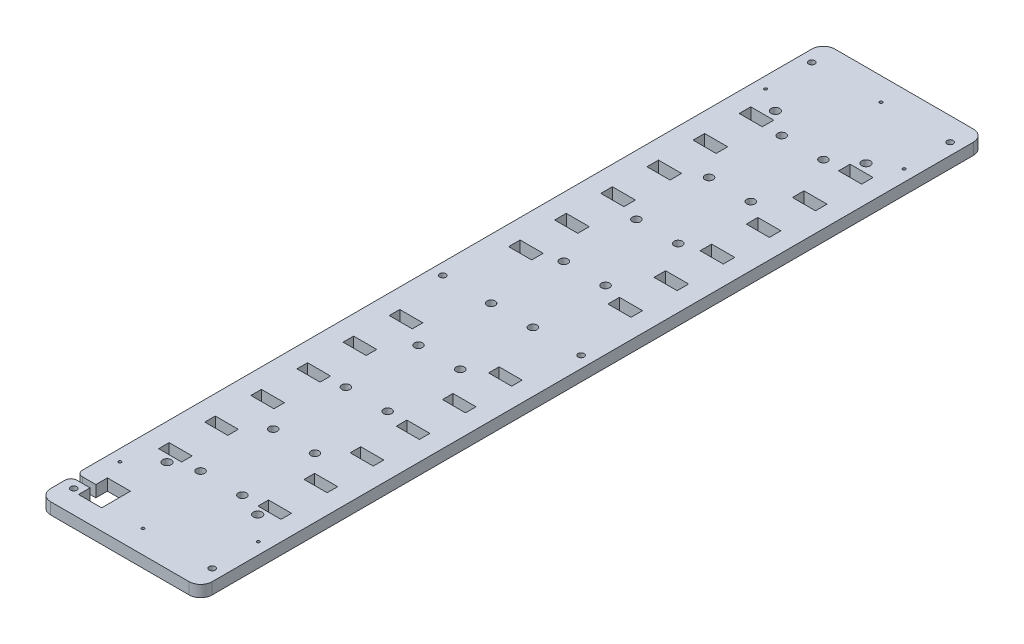
from build123d import *

# Parameters (mm, degrees)
SKETCH1_W                = 88.9
SKETCH1_H                = 431.8
BOSS_EXTRUDE1_DEPTH      = 6.35
M4_CLEARANCE_HOLE2_D     = 4.5
M4_CLEARANCE_HOLE2_DEPTH = 12.7
M4_CLEARANCE_HOLE2_TIP   = 1.351936393
M3_CLEARANCE_HOLE1_D     = 3.4
M3_CLEARANCE_HOLE1_DEPTH = 10
M3_CLEARANCE_HOLE1_TIP   = 1.021463052
SKETCH5_R                = 0.79375
CUT_EXTRUDE2_DEPTH       = 441.902225556
SKETCH6_W                = 12.7
SKETCH6_H                = 6.35
SKETCH6_H_2              = 5.8
CUT_EXTRUDE3_DEPTH       = 441.902225556
FILLET1_R                = 6.35
SKETCH10_R               = 2.38125
CUT_EXTRUDE4_DEPTH       = 441.902225556
CUT_EXTRUDE5_DEPTH       = 441.902225556
FILLET2_R                = 3.175


with BuildPart() as part:
    # Sketch1 → Boss-Extrude1 (new body)
    with BuildSketch(Plane(origin=(0, 0, 0), x_dir=(1, 0, 0), z_dir=(0, 1, 0))):
        with Locations((-44.45, -215.9)):
            Rectangle(SKETCH1_W, SKETCH1_H)
    extrude(amount=BOSS_EXTRUDE1_DEPTH)

    # M4 Clearance Hole2
    with Locations(Plane(origin=(0, 6.35, 0), x_dir=(-1, 0, 0), z_dir=(0, 1, 0))):
        with Locations((32.95, 215.9), (55.95, 215.9), (32.95, 255.9), (55.95, 255.9), (32.95, 295.9), (55.95, 295.9), (32.95, 335.9), (55.95, 335.9), (32.95, 375.9), (55.95, 375.9), (32.95, 175.9), (55.95, 175.9), (32.95, 135.9), (55.95, 135.9), (32.95, 95.9), (55.95, 95.9), (32.95, 55.9), (55.95, 55.9)):
            Hole(M4_CLEARANCE_HOLE2_D / 2, depth=M4_CLEARANCE_HOLE2_DEPTH)
            with Locations((0, 0, -(M4_CLEARANCE_HOLE2_DEPTH + M4_CLEARANCE_HOLE2_TIP / 2))):  # 118° drill point
                Cone(0, M4_CLEARANCE_HOLE2_D / 2, M4_CLEARANCE_HOLE2_TIP, mode=Mode.SUBTRACT)

    # M3 Clearance Hole1
    with Locations(Plane(origin=(0, 6.35, 0), x_dir=(-1, 0, 0), z_dir=(0, 1, 0))):
        with Locations((82.55, 12.7), (6.35, 12.7), (6.35, 419.1), (82.55, 419.1), (82.55, 215.9), (6.35, 215.9)):
            Hole(M3_CLEARANCE_HOLE1_D / 2, depth=M3_CLEARANCE_HOLE1_DEPTH)
            with Locations((0, 0, -(M3_CLEARANCE_HOLE1_DEPTH + M3_CLEARANCE_HOLE1_TIP / 2))):  # 118° drill point
                Cone(0, M3_CLEARANCE_HOLE1_D / 2, M3_CLEARANCE_HOLE1_TIP, mode=Mode.SUBTRACT)

    # Sketch5 → Cut-Extrude2 (cut, through all)
    with BuildSketch(Plane(origin=(0, 6.35, 0), x_dir=(1, 0, 0), z_dir=(0, 1, 0))):
        with Locations(Location((-44.45, -12.7, 0), (0, 0, 270))):
            Circle(SKETCH5_R)
        with Locations(Location((-82.55, -38.1, 0), (0, 0, 270))):
            Circle(SKETCH5_R)
        with Locations(Location((-6.35, -38.1, 0), (0, 0, 270))):
            Circle(SKETCH5_R)
        with Locations(Location((-6.35, -393.7, 0), (0, 0, 90))):
            Circle(SKETCH5_R)
        with Locations(Location((-82.55, -393.7, 0), (0, 0, 90))):
            Circle(SKETCH5_R)
        with Locations(Location((-44.45, -419.1, 0), (0, 0, 90))):
            Circle(SKETCH5_R)
    extrude(amount=-CUT_EXTRUDE2_DEPTH, mode=Mode.SUBTRACT)

    # Sketch6 → Cut-Extrude3 (cut, through all)
    with BuildSketch(Plane(origin=(0, 6.35, 0), x_dir=(-1, 0, 0), z_dir=(0, 1, 0))):
        with Locations((71.8, 53.9)):
            Rectangle(SKETCH6_W, SKETCH6_H)
        with Locations((17.1, 53.9)):
            Rectangle(SKETCH6_W, SKETCH6_H)
        with Locations((71.8, 373.9)):
            Rectangle(SKETCH6_W, SKETCH6_H_2)
        with Locations((17.1, 373.9)):
            Rectangle(SKETCH6_W, SKETCH6_H_2)
        with Locations((71.8, 348.5)):
            Rectangle(SKETCH6_W, SKETCH6_H_2)
        with Locations((17.1, 348.5)):
            Rectangle(SKETCH6_W, SKETCH6_H_2)
        with Locations((71.8, 323.1)):
            Rectangle(SKETCH6_W, SKETCH6_H_2)
        with Locations((17.1, 323.1)):
            Rectangle(SKETCH6_W, SKETCH6_H_2)
        with Locations((71.8, 297.7)):
            Rectangle(SKETCH6_W, SKETCH6_H_2)
        with Locations((17.1, 297.7)):
            Rectangle(SKETCH6_W, SKETCH6_H_2)
        with Locations((71.8, 272.3)):
            Rectangle(SKETCH6_W, SKETCH6_H_2)
        with Locations((17.1, 272.3)):
            Rectangle(SKETCH6_W, SKETCH6_H_2)
        with Locations((71.8, 246.9)):
            Rectangle(SKETCH6_W, SKETCH6_H_2)
        with Locations((17.1, 246.9)):
            Rectangle(SKETCH6_W, SKETCH6_H_2)
        with Locations((71.8, 79.3)):
            Rectangle(SKETCH6_W, SKETCH6_H)
        with Locations((17.1, 79.3)):
            Rectangle(SKETCH6_W, SKETCH6_H)
        with Locations((71.8, 104.7)):
            Rectangle(SKETCH6_W, SKETCH6_H)
        with Locations((17.1, 104.7)):
            Rectangle(SKETCH6_W, SKETCH6_H)
        with Locations((71.8, 130.1)):
            Rectangle(SKETCH6_W, SKETCH6_H)
        with Locations((17.1, 130.1)):
            Rectangle(SKETCH6_W, SKETCH6_H)
        with Locations((71.8, 155.5)):
            Rectangle(SKETCH6_W, SKETCH6_H)
        with Locations((17.1, 155.5)):
            Rectangle(SKETCH6_W, SKETCH6_H)
        with Locations((71.8, 180.9)):
            Rectangle(SKETCH6_W, SKETCH6_H)
        with Locations((17.1, 180.9)):
            Rectangle(SKETCH6_W, SKETCH6_H)
    extrude(amount=-CUT_EXTRUDE3_DEPTH, mode=Mode.SUBTRACT)

    # Fillet1
    fillet1_edges = [part.edges().sort_by_distance(p)[0] for p in [
        (0, 3.175, 431.8),
        (-88.9, 3.175, 431.8),
        (-88.9, 3.175, 0),
        (0, 3.175, 0),
    ]]
    fillet(fillet1_edges, radius=FILLET1_R)

    # Sketch10 → Cut-Extrude4 (cut, through all)
    with BuildSketch(Plane(origin=(0, 6.35, 0), x_dir=(1, 0, 0), z_dir=(0, 1, 0))):
        with Locations(Location((-19.48125, -380.9, 0), (0, 0, 270))):
            Circle(SKETCH10_R)
        with Locations(Location((-69.41875, -380.9, 0), (0, 0, 270))):
            Circle(SKETCH10_R)
        with Locations(Location((-69.41875, -45.9, 0), (0, 0, 270))):
            Circle(SKETCH10_R)
        with Locations(Location((-19.48125, -45.9, 0), (0, 0, 270))):
            Circle(SKETCH10_R)
    extrude(amount=-CUT_EXTRUDE4_DEPTH, mode=Mode.SUBTRACT)

    # Sketch11 → Cut-Extrude5 (cut, through all)
    with BuildSketch(Plane(origin=(0, 6.35, 0), x_dir=(1, 0, 0), z_dir=(0, 1, 0))):
        Polygon((-88.9, -411.1625), (-78.34884, -411.1625), (-78.34884, -404.8125), (-65.64884, -404.8125), (-65.64884, -420.6875), (-78.34884, -420.6875), (-78.34884, -414.3375), (-88.9, -414.3375), align=None)
    extrude(amount=-CUT_EXTRUDE5_DEPTH, mode=Mode.SUBTRACT)

    # Fillet2
    fillet2_edges = [part.edges().sort_by_distance(p)[0] for p in [
        (-88.9, 3.175, 414.3375),
        (-88.9, 3.175, 411.1625),
    ]]
    fillet(fillet2_edges, radius=FILLET2_R)


solid = part.part
